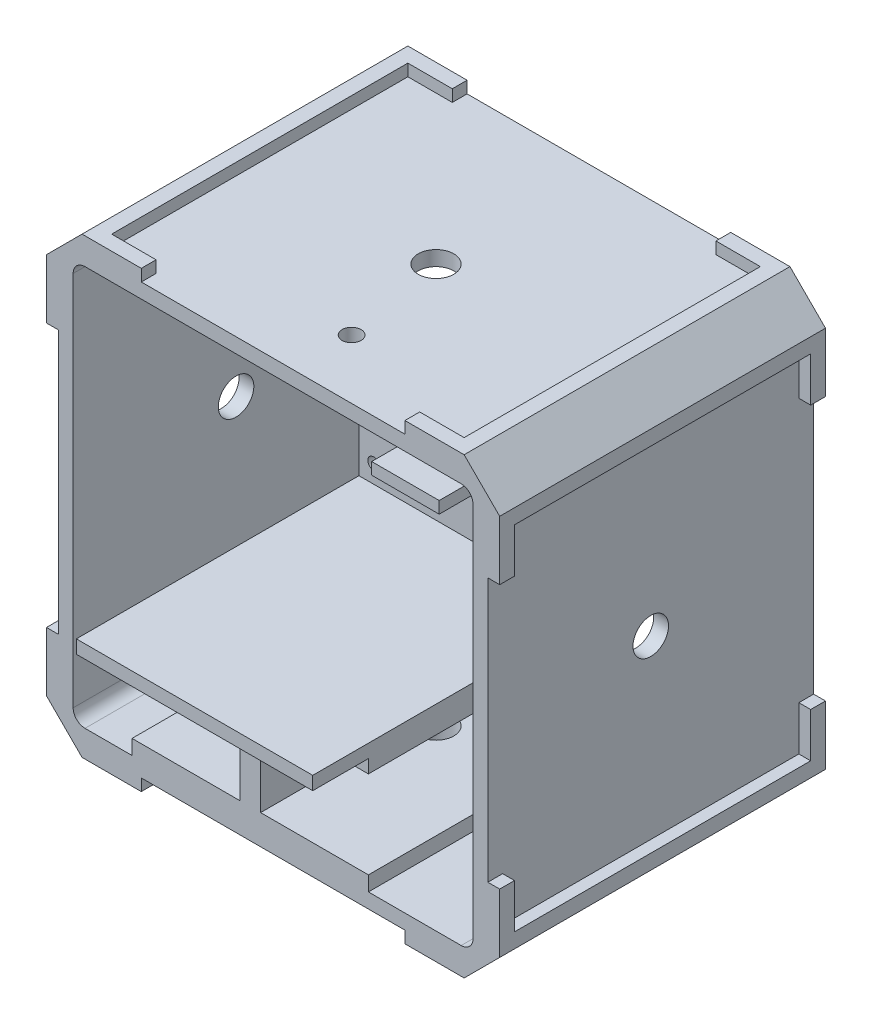
from build123d import *

# Parameters (mm, degrees)
BOSS_EXTRUDE1_DEPTH            = 55
SKETCH2_W                      = 67.5
SKETCH2_H                      = 67.5
BOSS_EXTRUDE2_DEPTH            = 2.5
CUT_EXTRUDE1_REACH             = 75.378
SKETCH3_W                      = 16.5
SKETCH3_H                      = 7
SKETCH3_W_2                    = 8
SKETCH3_H_2                    = 16
FILLET1_R                      = 1
CUT_EXTRUDE2_REACH             = 77.187
SKETCH4_R                      = 1.5
MIRROR2_COPY_1_REACH           = 77.187
MIRROR2_COPY_1_SKETCH_R        = 1.5
BOSS_EXTRUDE3_DEPTH            = 16.09
BOSS_EXTRUDE3_DEPTH_BACK       = 23.81
BOSS_EXTRUDE4_DEPTH            = 47
SKETCH7_W                      = 39.9
SKETCH7_H                      = 19.5
CUT_EXTRUDE3_DEPTH             = 9.4
BOSS_EXTRUDE7_DEPTH            = 2
CUT_EXTRUDE6_REACH             = 85.213
CUT_EXTRUDE6_DIRECTION_2_DEPTH = 84.213490493
CUT_EXTRUDE7_REACH             = 74.438
SKETCH14_W                     = 14.7
SKETCH14_H                     = 2
CUT_EXTRUDE8_DEPTH             = 104.526192338
CUT_EXTRUDE8_DEPTH_BACK        = 2.5
SKETCH15_R                     = 1.6
SKETCH16_W                     = 7.5
SKETCH16_H                     = 2.5
BOSS_EXTRUDE8_DEPTH            = 7
CUT_EXTRUDE5_DEPTH             = 2
CUT_EXTRUDE9_REACH             = 74.438
SKETCH17_R                     = 1
SKETCH19_R                     = 3
CUT_EXTRUDE10_DEPTH            = 2.5
BOSS_EXTRUDE9_DEPTH            = 2
CIRPATTERN1_COUNT              = 4
CIRPATTERN2_COUNT              = 4
CUT_EXTRUDE11_DEPTH            = 2.5
BOSS_EXTRUDE12_DEPTH           = 55


with BuildPart() as part:
    # Sketch1 → Boss-Extrude1 (new body)
    with BuildSketch(Plane.XY):
        with BuildLine():
            Line((-36.25, 32.25), (-36.25, -32.25))
            ThreePointArc((-36.25, -32.25), (-35.078427125, -35.078427125), (-32.25, -36.25))
            Line((-32.25, -36.25), (32.25, -36.25))
            ThreePointArc((32.25, -36.25), (35.078427125, -35.078427125), (36.25, -32.25))
            Line((36.25, -32.25), (36.25, 32.25))
            ThreePointArc((36.25, 32.25), (35.078427125, 35.078427125), (32.25, 36.25))
            Line((32.25, 36.25), (-32.25, 36.25))
            ThreePointArc((-32.25, 36.25), (-35.078427125, 35.078427125), (-36.25, 32.25))
        make_face()
        with BuildLine():
            Line((-31.75, 33.75), (31.75, 33.75))
            ThreePointArc((31.75, 33.75), (33.164213562, 33.164213562), (33.75, 31.75))
            Line((33.75, 31.75), (33.75, -31.75))
            ThreePointArc((33.75, -31.75), (33.164213562, -33.164213562), (31.75, -33.75))
            Line((31.75, -33.75), (-31.75, -33.75))
            ThreePointArc((-31.75, -33.75), (-33.164213562, -33.164213562), (-33.75, -31.75))
            Line((-33.75, -31.75), (-33.75, 31.75))
            ThreePointArc((-33.75, 31.75), (-33.164213562, 33.164213562), (-31.75, 33.75))
        make_face(mode=Mode.SUBTRACT)
    extrude(amount=BOSS_EXTRUDE1_DEPTH)

    # Sketch2 → Boss-Extrude2 (add)
    with BuildSketch(Plane.XY):
        Rectangle(SKETCH2_W, SKETCH2_H)
    extrude(amount=BOSS_EXTRUDE2_DEPTH)

    # Sketch3 → Cut-Extrude1 (cut, up to next)
    with BuildSketch(Plane.XY.offset(2.5), mode=Mode.PRIVATE) as cut_extrude1_sk1:
        with Locations((-11.63, 14.79)):
            Rectangle(SKETCH3_W, SKETCH3_H)
    cut_extrude1_tool1 = extrude(cut_extrude1_sk1.sketch, amount=-CUT_EXTRUDE1_REACH, mode=Mode.PRIVATE) & part.part
    # Sketch3 → Cut-Extrude1 (cut, up to next)
    with BuildSketch(Plane.XY.offset(2.5), mode=Mode.PRIVATE) as cut_extrude1_sk2:
        Rectangle(SKETCH3_W_2, SKETCH3_H_2)
    cut_extrude1_tool2 = extrude(cut_extrude1_sk2.sketch, amount=-CUT_EXTRUDE1_REACH, mode=Mode.PRIVATE) & part.part
    add(cut_extrude1_tool1.solids().sort_by_distance((-11.63, 14.79, 2.5))[0], mode=Mode.SUBTRACT)
    add(cut_extrude1_tool2.solids().sort_by_distance((0, 0, 2.5))[0], mode=Mode.SUBTRACT)

    # Fillet1
    fillet1_edges = [part.edges().sort_by_distance(p)[0] for p in [
        (-19.88, 11.29, 1.25),
        (-19.88, 18.29, 1.25),
        (-3.38, 18.29, 1.25),
        (-3.38, 11.29, 1.25),
        (4, -8, 1.25),
        (-4, -8, 1.25),
        (-4, 8, 1.25),
        (4, 8, 1.25),
    ]]
    fillet(fillet1_edges, radius=FILLET1_R)

    # Sketch4 → Cut-Extrude2 (cut, up to next)
    with BuildSketch(Plane(origin=(0, 0, 0), x_dir=(-1, 0, 0), z_dir=(0, 0, -1)), mode=Mode.PRIVATE) as cut_extrude2_sk1:
        with Locations((-28.75, 28.75)):
            Circle(SKETCH4_R)
    cut_extrude2_tool1 = extrude(cut_extrude2_sk1.sketch, amount=-CUT_EXTRUDE2_REACH, mode=Mode.PRIVATE) & part.part
    cut_extrude2 = cut_extrude2_tool1.solids().sort_by_distance((28.75, 28.75, 0))[0]
    add(cut_extrude2, mode=Mode.SUBTRACT)

    # Mirror1: Cut-Extrude2 across plane
    add(cut_extrude2.mirror(Plane(origin=(0, 0, 0), x_dir=(0, 0, 1), z_dir=(1, 0, 0))), mode=Mode.SUBTRACT)

    # Mirror2: Cut-Extrude2 across plane
    add(cut_extrude2.mirror(Plane.ZX), mode=Mode.SUBTRACT)

    # Mirror2 copy 1 sketch → Mirror2 copy 1 (cut, up to next)
    with BuildSketch(Plane(origin=(0, 0, 0), x_dir=(1, 0, 0), z_dir=(0, 0, -1)), mode=Mode.PRIVATE) as mirror2_copy_1_sk1:
        with Locations((-28.75, 28.75)):
            Circle(MIRROR2_COPY_1_SKETCH_R)
    mirror2_copy_1_tool1 = extrude(mirror2_copy_1_sk1.sketch, amount=-MIRROR2_COPY_1_REACH, mode=Mode.PRIVATE) & part.part
    add(mirror2_copy_1_tool1.solids().sort_by_distance((-28.75, -28.75, 0))[0], mode=Mode.SUBTRACT)



with BuildPart() as body_2:
    # Sketch5 → Boss-Extrude3 (new, two sides: drawn at the far end of the back side and taken through both)
    with BuildSketch(Plane(origin=(0, 0, 0), x_dir=(0, 0, -1), z_dir=(1, 0, 0)).offset(-BOSS_EXTRUDE3_DEPTH_BACK)):
        Polygon((-14.7, 14), (-64.4, 14), (-64.4, 12), (-62.4, 12), (-16.7, 12), (-16.7, -12), (-62.4, -12), (-64.4, -12), (-64.4, -14), (-14.7, -14), align=None)
    extrude(amount=BOSS_EXTRUDE3_DEPTH + BOSS_EXTRUDE3_DEPTH_BACK)


with BuildPart() as part_1:
    add(part.part)

    add(body_2.part)  # Boss-Extrude4 merges body 2
    # Sketch6 → Boss-Extrude4 (add)
    with BuildSketch(Plane.XY.offset(64.4)):
        Polygon((-23.81, -14), (16.09, -14), (16.09, -16.5), (-2.11, -16.5), (-2.11, -31.25), (16.09, -31.25), (16.09, -33.75), (-23.81, -33.75), (-23.81, -31.25), (-5.61, -31.25), (-5.61, -16.5), (-23.81, -16.5), align=None)
    extrude(amount=-BOSS_EXTRUDE4_DEPTH)

    # Sketch7 → Cut-Extrude3 (cut)
    with BuildSketch(Plane.XY.offset(64.4)):
        with Locations((-3.86, -24)):
            Rectangle(SKETCH7_W, SKETCH7_H)
    extrude(amount=-CUT_EXTRUDE3_DEPTH, mode=Mode.SUBTRACT)

    # Sketch12 → Boss-Extrude7 (add)
    with BuildSketch(Plane(origin=(0, 36.25, 0), x_dir=(1, 0, 0), z_dir=(0, 1, 0))):
        Polygon((29.75, -55), (32.25, -55), (32.25, -52.5), (32.25, -45), (29.75, -45), (29.75, -52.5), (22.25, -52.5), (22.25, -55), align=None)
        Polygon((-32.25, 0), (-32.25, -10), (-29.75, -10), (-29.75, -2.5), (-22.25, -2.5), (-22.25, 0), align=None)
    boss_extrude7 = extrude(amount=BOSS_EXTRUDE7_DEPTH)

    # Sketch13 → Cut-Extrude6 (cut, up to next)
    with BuildSketch(Plane(origin=(0, 0, 0), x_dir=(-1, 0, 0), z_dir=(0, 0, -1)), mode=Mode.PRIVATE) as cut_extrude6_sk1:
        with BuildLine():
            Line((-33.75, 21.25), (-25.25, 21.25))
            ThreePointArc((-25.25, 21.25), (-22.421572875, 22.421572875), (-21.25, 25.25))
            Line((-21.25, 25.25), (-21.25, 33.75))
            Line((-21.25, 33.75), (21.25, 33.75))
            Line((21.25, 33.75), (21.25, 25.25))
            ThreePointArc((21.25, 25.25), (22.421572875, 22.421572875), (25.25, 21.25))
            Line((25.25, 21.25), (33.75, 21.25))
            Line((33.75, 21.25), (33.75, -21.25))
            Line((33.75, -21.25), (25.25, -21.25))
            ThreePointArc((25.25, -21.25), (22.421572875, -22.421572875), (21.25, -25.25))
            Line((21.25, -25.25), (21.25, -33.75))
            Line((21.25, -33.75), (-21.25, -33.75))
            Line((-21.25, -33.75), (-21.25, -25.25))
            ThreePointArc((-21.25, -25.25), (-22.421572875, -22.421572875), (-25.25, -21.25))
            Line((-25.25, -21.25), (-33.75, -21.25))
            Line((-33.75, -21.25), (-33.75, 21.25))
        make_face()
    cut_extrude6_tool1 = extrude(cut_extrude6_sk1.sketch, amount=-CUT_EXTRUDE6_REACH, mode=Mode.PRIVATE) & part_1.part
    add(cut_extrude6_tool1.solids().sort_by_distance((0, 0, 0))[0], mode=Mode.SUBTRACT)

    # Sketch13 → Cut-Extrude6 direction 2 (cut)
    with BuildSketch(Plane(origin=(0, 0, 0), x_dir=(-1, 0, 0), z_dir=(0, 0, -1))):
        with BuildLine():
            Line((-33.75, 21.25), (-25.25, 21.25))
            ThreePointArc((-25.25, 21.25), (-22.421572875, 22.421572875), (-21.25, 25.25))
            Line((-21.25, 25.25), (-21.25, 33.75))
            Line((-21.25, 33.75), (21.25, 33.75))
            Line((21.25, 33.75), (21.25, 25.25))
            ThreePointArc((21.25, 25.25), (22.421572875, 22.421572875), (25.25, 21.25))
            Line((25.25, 21.25), (33.75, 21.25))
            Line((33.75, 21.25), (33.75, -21.25))
            Line((33.75, -21.25), (25.25, -21.25))
            ThreePointArc((25.25, -21.25), (22.421572875, -22.421572875), (21.25, -25.25))
            Line((21.25, -25.25), (21.25, -33.75))
            Line((21.25, -33.75), (-21.25, -33.75))
            Line((-21.25, -33.75), (-21.25, -25.25))
            ThreePointArc((-21.25, -25.25), (-22.421572875, -22.421572875), (-25.25, -21.25))
            Line((-25.25, -21.25), (-33.75, -21.25))
            Line((-33.75, -21.25), (-33.75, 21.25))
        make_face()
    extrude(amount=CUT_EXTRUDE6_DIRECTION_2_DEPTH, mode=Mode.SUBTRACT)

    # Sketch14 → Cut-Extrude7 (cut, up to next)
    with BuildSketch(Plane(origin=(0, 0, 14.7), x_dir=(-1, 0, 0), z_dir=(0, 0, -1)), mode=Mode.PRIVATE) as cut_extrude7_sk1:
        with Locations((16.46, 13)):
            Rectangle(SKETCH14_W, SKETCH14_H)
    cut_extrude7_tool1 = extrude(cut_extrude7_sk1.sketch, amount=-CUT_EXTRUDE7_REACH, mode=Mode.PRIVATE) & part_1.part
    add(cut_extrude7_tool1.solids().sort_by_distance((-16.46, 13, 14.7))[0], mode=Mode.SUBTRACT)

    # Sketch15 → Cut-Extrude8 (cut, two sides: drawn at the far end of the back side and taken through both)
    with BuildSketch(Plane(origin=(0, 36.25, 0), x_dir=(1, 0, 0), z_dir=(0, 1, 0)).offset(-CUT_EXTRUDE8_DEPTH_BACK)):
        with Locations(Location((3.25, -45, 0), (0, 0, 90))):
            Circle(SKETCH15_R)
    extrude(amount=CUT_EXTRUDE8_DEPTH + CUT_EXTRUDE8_DEPTH_BACK, mode=Mode.SUBTRACT)

    # Sketch16 → Boss-Extrude8 (add)
    with BuildSketch(Plane(origin=(-33.75, 0, 0), x_dir=(0, 0, -1), z_dir=(1, 0, 0))):
        with Locations((-12.25, 30.9)):
            Rectangle(SKETCH16_W, SKETCH16_H)
    extrude(amount=BOSS_EXTRUDE8_DEPTH)

    # Sketch11 → Cut-Extrude5 (cut)
    with BuildSketch(Plane(origin=(0, 14, 0), x_dir=(1, 0, 0), z_dir=(0, 1, 0))):
        Polygon((1.19, -39.55), (12.59, -39.55), (12.59, -14.7), (16.09, -14.7), (16.09, -64.4), (12.59, -64.4), (1.19, -64.4), (-23.81, -64.4), (-23.81, -14.7), (1.19, -14.7), align=None)
    extrude(amount=-CUT_EXTRUDE5_DEPTH, mode=Mode.SUBTRACT)

    # Sketch17 → Cut-Extrude9 (cut, up to next)
    with BuildSketch(Plane(origin=(0, 0, 14.7), x_dir=(-1, 0, 0), z_dir=(0, 0, -1)), mode=Mode.PRIVATE) as cut_extrude9_sk1:
        with Locations(Location((-13.59, 9, 0), (0, 0, 90))):
            Circle(SKETCH17_R)
    cut_extrude9_tool1 = extrude(cut_extrude9_sk1.sketch, amount=-CUT_EXTRUDE9_REACH, mode=Mode.PRIVATE) & part_1.part
    # Sketch17 → Cut-Extrude9 (cut, up to next)
    with BuildSketch(Plane(origin=(0, 0, 14.7), x_dir=(-1, 0, 0), z_dir=(0, 0, -1)), mode=Mode.PRIVATE) as cut_extrude9_sk2:
        with Locations(Location((-13.59, -9, 0), (0, 0, 90))):
            Circle(SKETCH17_R)
    cut_extrude9_tool2 = extrude(cut_extrude9_sk2.sketch, amount=-CUT_EXTRUDE9_REACH, mode=Mode.PRIVATE) & part_1.part
    # Sketch17 → Cut-Extrude9 (cut, up to next)
    with BuildSketch(Plane(origin=(0, 0, 14.7), x_dir=(-1, 0, 0), z_dir=(0, 0, -1)), mode=Mode.PRIVATE) as cut_extrude9_sk3:
        with Locations(Location((21.31, -9, 0), (0, 0, 90))):
            Circle(SKETCH17_R)
    cut_extrude9_tool3 = extrude(cut_extrude9_sk3.sketch, amount=-CUT_EXTRUDE9_REACH, mode=Mode.PRIVATE) & part_1.part
    add(cut_extrude9_tool1.solids().sort_by_distance((13.59, 9, 14.7))[0], mode=Mode.SUBTRACT)
    add(cut_extrude9_tool2.solids().sort_by_distance((13.59, -9, 14.7))[0], mode=Mode.SUBTRACT)
    add(cut_extrude9_tool3.solids().sort_by_distance((-21.31, -9, 14.7))[0], mode=Mode.SUBTRACT)

    # Sketch19 → Cut-Extrude10 (cut)
    with BuildSketch(Plane(origin=(0, 36.25, 0), x_dir=(1, 0, 0), z_dir=(0, 1, 0))):
        with Locations(Location((0, -27.5, 0), (0, 0, 270))):
            Circle(SKETCH19_R)
    cut_extrude10 = extrude(amount=-CUT_EXTRUDE10_DEPTH, mode=Mode.SUBTRACT)

    # Sketch20 → Boss-Extrude9 (add)
    with BuildSketch(Plane(origin=(36.25, 0, -36.25), x_dir=(0, 0, 1), z_dir=(-1, 0, 0))):
        Polygon((91.25, 32.25), (81.25, 32.25), (81.25, 29.75), (88.75, 29.75), (88.75, 22.25), (91.25, 22.25), align=None)
        Polygon((36.25, -22.25), (36.25, -32.25), (46.25, -32.25), (46.25, -29.75), (38.75, -29.75), (38.75, -22.25), align=None)
    boss_extrude9 = extrude(amount=-BOSS_EXTRUDE9_DEPTH)

    # CirPattern1: Boss-Extrude7, Cut-Extrude10 ×4 about axis
    cirpattern1_axis = Axis((0, 0, 0), (0, 0, 1))
    add([boss_extrude7.rotate(cirpattern1_axis, i * 360 / CIRPATTERN1_COUNT) for i in range(1, CIRPATTERN1_COUNT)])
    add([cut_extrude10.rotate(cirpattern1_axis, i * 360 / CIRPATTERN1_COUNT) for i in range(1, CIRPATTERN1_COUNT)], mode=Mode.SUBTRACT)

    # CirPattern2: Boss-Extrude9 ×4 about axis
    cirpattern2_axis = Axis((0, 0, 0), (0, 0, 1))
    for i in range(1, CIRPATTERN2_COUNT):
        add(boss_extrude9.rotate(cirpattern2_axis, i * 360 / CIRPATTERN2_COUNT))

    # Sketch21 → Cut-Extrude11 (cut)
    with BuildSketch(Plane.XZ.offset(33.75)):
        with BuildLine():
            Line((-2.11, 25.367419404), (-2.11, 29.632580596))
            ThreePointArc((-2.11, 29.632580596), (3, 27.5), (-2.11, 25.367419404))
        make_face()
    extrude(amount=-CUT_EXTRUDE11_DEPTH, mode=Mode.SUBTRACT)

    # Sketch22 → Boss-Extrude12 (add, through all)
    with BuildSketch(Plane.XY.offset(55)):
        Polygon((-38.25, 32.25), (-32.25, 38.25), (-29.75, 38.25), (-29.75, 33.75), (-33.75, 33.75), (-33.75, 29.75), (-38.25, 29.75), align=None)
        Polygon((33.75, 33.75), (33.75, 29.75), (38.25, 29.75), (38.25, 32.25), (32.25, 38.25), (29.75, 38.25), (29.75, 33.75), align=None)
        Polygon((38.25, -32.25), (32.25, -38.25), (29.75, -38.25), (29.75, -33.75), (33.75, -33.75), (33.75, -29.75), (38.25, -29.75), align=None)
        Polygon((-33.75, -33.75), (-33.75, -29.75), (-38.25, -29.75), (-38.25, -32.25), (-32.25, -38.25), (-29.75, -38.25), (-29.75, -33.75), align=None)
    extrude(amount=-BOSS_EXTRUDE12_DEPTH)


solid = part_1.part
